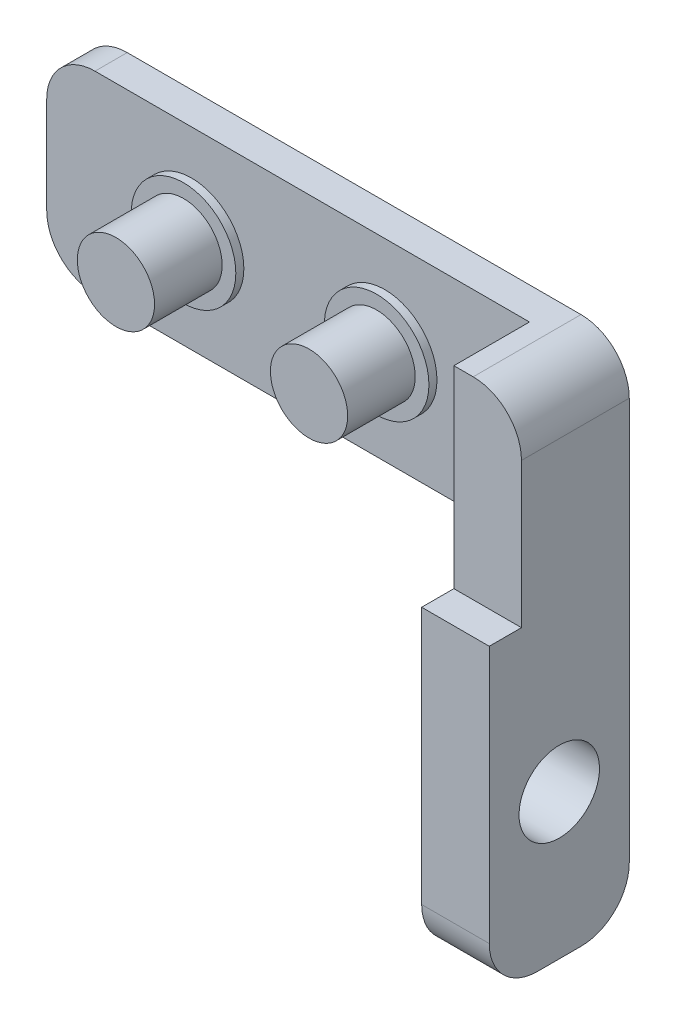
from build123d import *

# Parameters (mm, degrees)
ESQUISSE1_W             = 30
ESQUISSE1_H             = 12
BOSS_EXTRU_1_DEPTH      = 2
ESQUISSE2_R             = 3.25
BOSS_EXTRU_2_DEPTH      = 0.5
ESQUISSE3_R             = 2.4
BOSS_EXTRU_3_DEPTH      = 4.2
ESQUISSE6_W             = 6.7
ESQUISSE6_H             = 31
BOSS_EXTRU_4_DEPTH      = 4.2
ESQUISSE8_W             = 4.2
ESQUISSE8_H             = 19
BOSS_EXTRU_5_DEPTH      = 2
ESQUISSE9_R             = 2.5
ENL_V_MAT_EXTRU_1_DEPTH = 4.2
CONG_1_R                = 3


with BuildPart() as part:
    # Esquisse1 → Boss.-Extru.1 (new body)
    with BuildSketch(Plane.XY):
        with Locations((2.190701098, -1.023529412)):
            Rectangle(ESQUISSE1_W, ESQUISSE1_H)
    extrude(amount=BOSS_EXTRU_1_DEPTH)

    # Esquisse2 → Boss.-Extru.2 (add)
    with BuildSketch(Plane.XY.offset(2)):
        with Locations((8.190701098, -1.023529412)):
            Circle(ESQUISSE2_R)
        with Locations((-3.809298902, -1.023529412)):
            Circle(ESQUISSE2_R)
    extrude(amount=BOSS_EXTRU_2_DEPTH)

    # Esquisse3 → Boss.-Extru.3 (add)
    with BuildSketch(Plane.XY.offset(2.5)):
        with Locations((-3.809298902, -1.023529412)):
            Circle(ESQUISSE3_R)
        with Locations((8.190701098, -1.023529412)):
            Circle(ESQUISSE3_R)
    extrude(amount=BOSS_EXTRU_3_DEPTH)

    # Esquisse6 → Boss.-Extru.4 (add)
    with BuildSketch(Plane(origin=(17.190701098, 0, 0), x_dir=(0, 0, -1), z_dir=(1, 0, 0))):
        with Locations((-3.35, -10.523529412)):
            Rectangle(ESQUISSE6_W, ESQUISSE6_H)
    extrude(amount=BOSS_EXTRU_4_DEPTH)

    # Esquisse8 → Boss.-Extru.5 (add)
    with BuildSketch(Plane.XY.offset(6.7)):
        with Locations((19.290701098, -16.523529412)):
            Rectangle(ESQUISSE8_W, ESQUISSE8_H)
    extrude(amount=BOSS_EXTRU_5_DEPTH)

    # Esquisse9 → Enlèv. mat.-Extru.1 (cut)
    with BuildSketch(Plane.ZY.offset(-17.190701098)):
        with Locations(Location((4.35, -17.023529412, 0), (0, 0, 270))):
            Circle(ESQUISSE9_R)
    extrude(amount=-ENL_V_MAT_EXTRU_1_DEPTH, mode=Mode.SUBTRACT)

    # Congé1
    cong_1_edges = [part.edges().sort_by_distance(p)[0] for p in [
        (19.290701098, -26.023529412, 0),
        (21.390701098, 4.976470588, 3.35),
        (19.290701098, -26.023529412, 8.7),
        (-12.809298902, 4.976470588, 1),
        (-12.809298902, -7.023529412, 1),
    ]]
    fillet(cong_1_edges, radius=CONG_1_R)


solid = part.part
